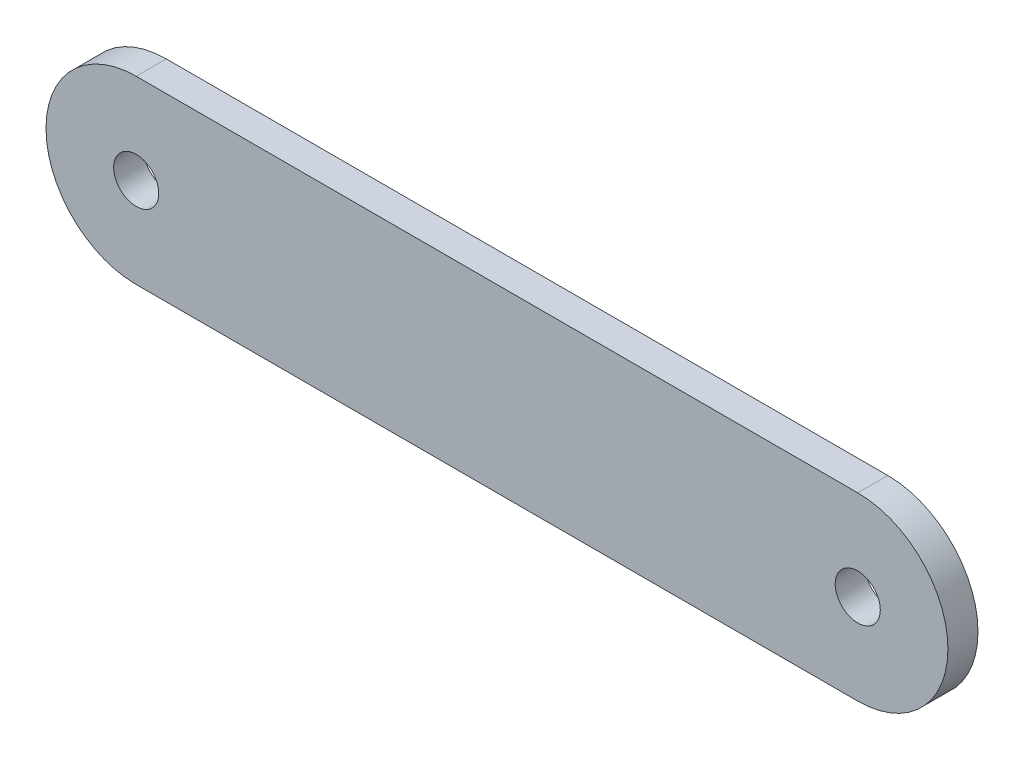
from build123d import *

# Parameters (mm, degrees)
SKETCH1_R           = 4.7625
BOSS_EXTRUDE1_DEPTH = 6.35


with BuildPart() as part:
    # Sketch1 → Boss-Extrude1 (new body)
    with BuildSketch(Plane.XY):
        with BuildLine():
            Line((0, 19.05), (152.4, 19.05))
            ThreePointArc((152.4, 19.05), (171.45, 0), (152.4, -19.05))
            Line((152.4, -19.05), (0, -19.05))
            ThreePointArc((0, -19.05), (-19.05, 0), (0, 19.05))
        make_face()
        Circle(SKETCH1_R, mode=Mode.SUBTRACT)
        with Locations((152.4, 0)):
            Circle(SKETCH1_R, mode=Mode.SUBTRACT)
    extrude(amount=BOSS_EXTRUDE1_DEPTH)


solid = part.part
